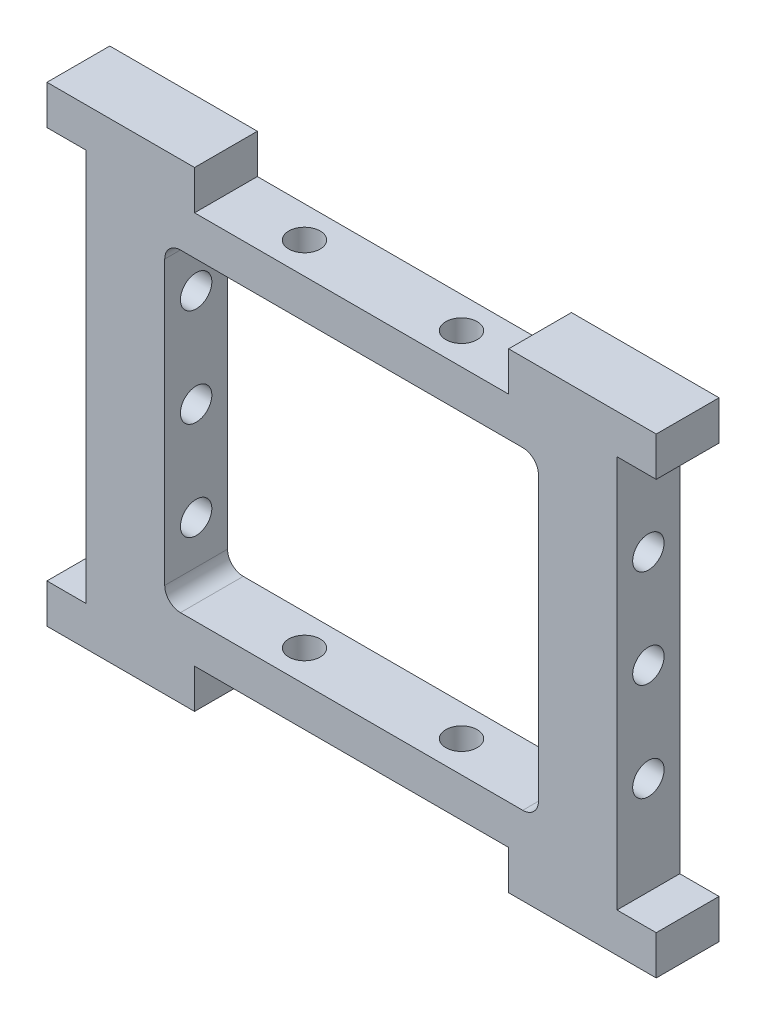
from build123d import *

# Parameters (mm, degrees)
SKETCH_1_W          = 67.6
SKETCH_1_H          = 50
EXTRUDE_1_DEPTH     = 8
SKETCH_2_R          = 2
CUT_EXTRUDE_1_DEPTH = 10
SKETCH_3_R          = 2
CUT_EXTRUDE_2_DEPTH = 10
SKETCH_4_W          = 18.8
SKETCH_4_H          = 5
EXTRUDE_2_DEPTH     = 8
SKETCH_5_W          = 47.6
SKETCH_5_H          = 40
CUT_EXTRUDE_3_DEPTH = 8
FILLET_1_R          = 2


with BuildPart() as part:
    # 草图1 → 凸台-拉伸1 (new body)
    with BuildSketch(Plane.XY):
        with Locations((33.8, 25)):
            Rectangle(SKETCH_1_W, SKETCH_1_H)
    extrude(amount=EXTRUDE_1_DEPTH)

    # 草图2 → 切除-拉伸1 (cut)
    with BuildSketch(Plane.ZY):
        with Locations((4, 37.5)):
            Circle(SKETCH_2_R)
        with Locations((4, 25)):
            Circle(SKETCH_2_R)
        with Locations((4, 12.5)):
            Circle(SKETCH_2_R)
    cut_extrude_1 = extrude(amount=-CUT_EXTRUDE_1_DEPTH, mode=Mode.SUBTRACT)

    # 镜向1: 切除-拉伸1 across plane
    add(cut_extrude_1.mirror(Plane(origin=(33.8, 0, 0), x_dir=(0, 0, 1), z_dir=(1, 0, 0))), mode=Mode.SUBTRACT)

    # 草图3 → 切除-拉伸2 (cut)
    with BuildSketch(Plane(origin=(0, 50, 0), x_dir=(1, 0, 0), z_dir=(0, 1, 0))):
        with Locations(Location((23.8, -4, 0), (0, 0, 270))):
            Circle(SKETCH_3_R)
        with Locations(Location((43.8, -4, 0), (0, 0, 270))):
            Circle(SKETCH_3_R)
    cut_extrude_2 = extrude(amount=-CUT_EXTRUDE_2_DEPTH, mode=Mode.SUBTRACT)

    # 镜向2: 切除-拉伸2 across plane
    add(cut_extrude_2.mirror(Plane.ZX.offset(25)), mode=Mode.SUBTRACT)

    # 草图4 → 凸台-拉伸2 (add)
    with BuildSketch(Plane(origin=(0, 0, 0), x_dir=(-1, 0, 0), z_dir=(0, 0, -1))):
        with Locations((-63.2, 52.5)):
            Rectangle(SKETCH_4_W, SKETCH_4_H)
        with Locations((-63.2, -2.5)):
            Rectangle(SKETCH_4_W, SKETCH_4_H)
        with Locations((-4.4, -2.5)):
            Rectangle(SKETCH_4_W, SKETCH_4_H)
        with Locations((-4.4, 52.5)):
            Rectangle(SKETCH_4_W, SKETCH_4_H)
    extrude(amount=-EXTRUDE_2_DEPTH)

    # 草图5 → 切除-拉伸3 (cut)
    with BuildSketch(Plane(origin=(0, 0, 0), x_dir=(-1, 0, 0), z_dir=(0, 0, -1))):
        with Locations((-33.8, 25)):
            Rectangle(SKETCH_5_W, SKETCH_5_H)
    extrude(amount=-CUT_EXTRUDE_3_DEPTH, mode=Mode.SUBTRACT)

    # 圆角1
    fillet_1_edges = [part.edges().sort_by_distance(p)[0] for p in [
        (10, 45, 4),
        (57.6, 45, 4),
        (57.6, 5, 4),
        (10, 5, 4),
    ]]
    fillet(fillet_1_edges, radius=FILLET_1_R)


solid = part.part
